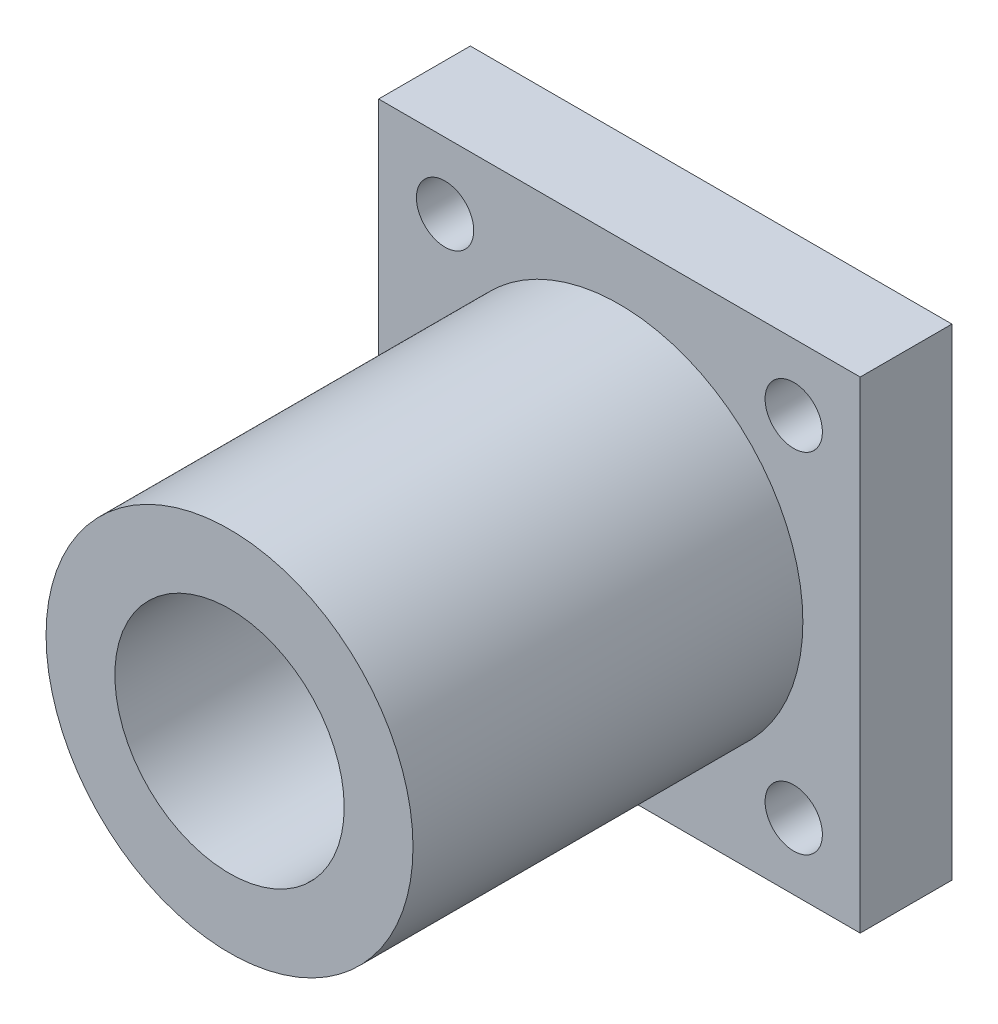
from build123d import *

# Parameters (mm, degrees)
SKETCH_1_W      = 42
SKETCH_1_H      = 42
SKETCH_1_R      = 2.5
SKETCH_1_R_2    = 10
EXTRUDE_1_DEPTH = 8
SKETCH_1_3_R    = 16
SKETCH_1_3_R_2  = 10
EXTRUDE_2_DEPTH = 42


with BuildPart() as part:
    # 草图1 → 凸台-拉伸1 (new body)
    with BuildSketch(Plane.XY):
        Rectangle(SKETCH_1_W, SKETCH_1_H)
        with Locations((-15.202795796, -15.202795796)):
            Circle(SKETCH_1_R, mode=Mode.SUBTRACT)
        with Locations((15.202795796, -15.202795796)):
            Circle(SKETCH_1_R, mode=Mode.SUBTRACT)
        with Locations((-15.202795796, 15.202795796)):
            Circle(SKETCH_1_R, mode=Mode.SUBTRACT)
        with Locations((15.202795796, 15.202795796)):
            Circle(SKETCH_1_R, mode=Mode.SUBTRACT)
        Circle(SKETCH_1_R_2, mode=Mode.SUBTRACT)
    extrude(amount=EXTRUDE_1_DEPTH)

    # 草图1<3> → 凸台-拉伸2 (add)
    with BuildSketch(Plane.XY):
        Circle(SKETCH_1_3_R)
        Circle(SKETCH_1_3_R_2, mode=Mode.SUBTRACT)
    extrude(amount=EXTRUDE_2_DEPTH)


solid = part.part
